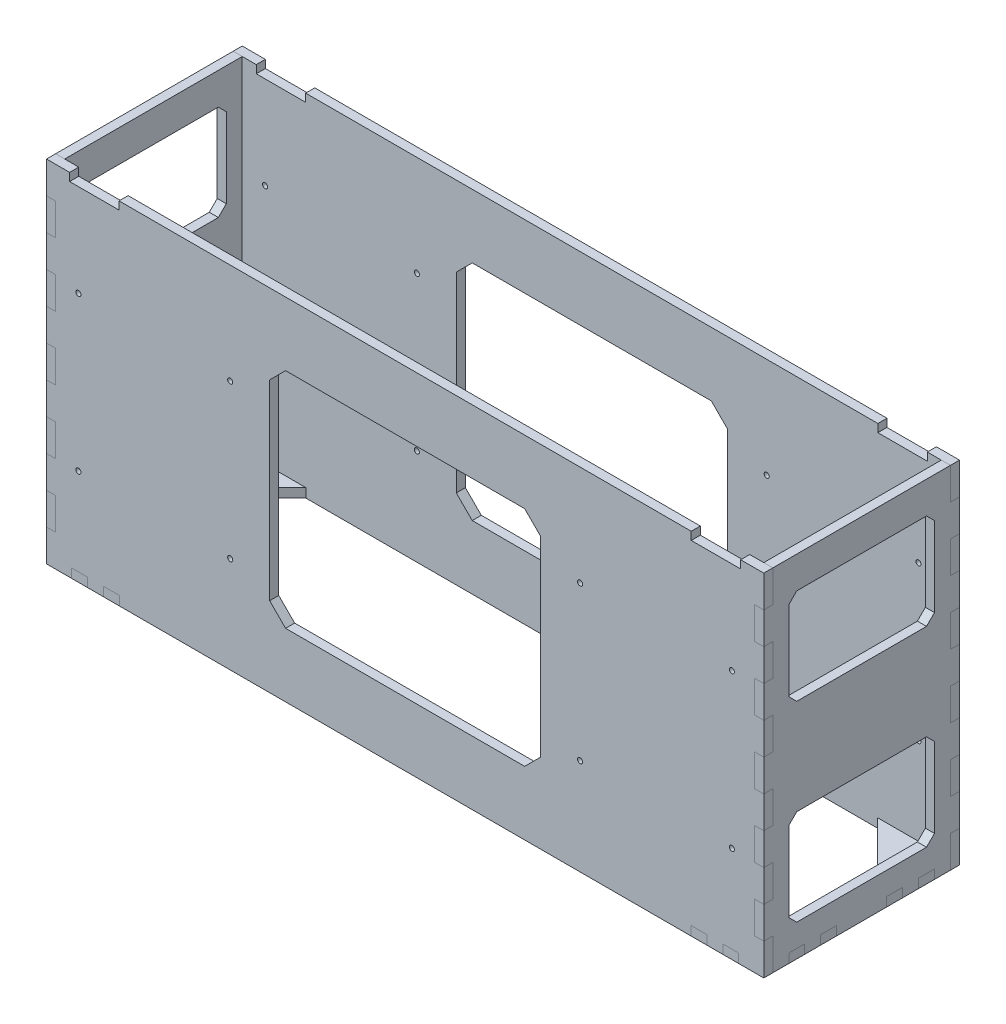
from build123d import *

# Parameters (mm, degrees)
SKETCH1_W                  = 450
SKETCH1_H                  = 220
SKETCH1_R                  = 1.6
BOSS_EXTRUDE1_DEPTH        = 5.7
CUT_EXTRUDE4_DEPTH         = 5.7
SKETCH2_W                  = 5.7
SKETCH2_H                  = 20
CUT_EXTRUDE1_DEPTH         = 5.7
LPATTERN1_COUNT            = 5
LPATTERN1_PITCH            = 40
MIRROR5_COPY_1_SKETCH_W    = 5.7
MIRROR5_COPY_1_SKETCH_H    = 20
MIRROR5_COPY_1_DEPTH       = 5.7
MIRROR5_COPY_2_SKETCH_W    = 5.7
MIRROR5_COPY_2_SKETCH_H    = 20
MIRROR5_COPY_2_DEPTH       = 5.7
MIRROR5_COPY_3_SKETCH_W    = 5.7
MIRROR5_COPY_3_SKETCH_H    = 20
MIRROR5_COPY_3_DEPTH       = 5.7
MIRROR5_COPY_4_SKETCH_W    = 5.7
MIRROR5_COPY_4_SKETCH_H    = 20
MIRROR5_COPY_4_DEPTH       = 5.7
SKETCH4_W                  = 122.8
SKETCH4_H                  = 220
BOSS_EXTRUDE2_DEPTH        = 5.7
SKETCH6_W                  = 5.7
SKETCH6_H                  = 20
CUT_EXTRUDE2_DEPTH         = 5.7
LPATTERN2_COUNT            = 6
LPATTERN2_PITCH            = 40
MIRROR3_COPY_1_SKETCH_W    = 5.7
MIRROR3_COPY_1_SKETCH_H    = 20
MIRROR3_COPY_1_DEPTH       = 5.7
MIRROR3_COPY_2_SKETCH_W    = 5.7
MIRROR3_COPY_2_SKETCH_H    = 20
MIRROR3_COPY_2_DEPTH       = 5.7
MIRROR3_COPY_3_SKETCH_W    = 5.7
MIRROR3_COPY_3_SKETCH_H    = 20
MIRROR3_COPY_3_DEPTH       = 5.7
MIRROR3_COPY_4_SKETCH_W    = 5.7
MIRROR3_COPY_4_SKETCH_H    = 20
MIRROR3_COPY_4_DEPTH       = 5.7
MIRROR3_COPY_5_SKETCH_W    = 5.7
MIRROR3_COPY_5_SKETCH_H    = 20
MIRROR3_COPY_5_DEPTH       = 5.7
CUT_EXTRUDE3_DEPTH         = 5.7
SKETCH9_W                  = 31
SKETCH9_H                  = 5
CUT_EXTRUDE5_DEPTH         = 516.732333677
SKETCH11_W                 = 10
SKETCH11_H                 = 5.7
SKETCH11_W_2               = 5.7
SKETCH11_H_2               = 10
CUT_EXTRUDE6_DEPTH         = 5.7
BOSS_EXTRUDE3_DEPTH        = 5.7
MIRROR12_COPY_1_SKETCH_W   = 10
MIRROR12_COPY_1_SKETCH_H   = 5.7
MIRROR12_COPY_1_SKETCH_W_2 = 5.7
MIRROR12_COPY_1_SKETCH_H_2 = 10
MIRROR12_COPY_1_DEPTH      = 5.7


with BuildPart() as part:
    # Sketch1 → Boss-Extrude1 (new body)
    with BuildSketch(Plane.XY):
        with Locations((225, 110)):
            Rectangle(SKETCH1_W, SKETCH1_H)
        with Locations((20, 157)):
            Circle(SKETCH1_R, mode=Mode.SUBTRACT)
        with Locations((115.25, 157)):
            Circle(SKETCH1_R, mode=Mode.SUBTRACT)
        with Locations((115.25, 60.48)):
            Circle(SKETCH1_R, mode=Mode.SUBTRACT)
        with Locations((20, 60.48)):
            Circle(SKETCH1_R, mode=Mode.SUBTRACT)
        with Locations(Location((430, 60.48, 0), (0, 0, 180))):
            Circle(SKETCH1_R, mode=Mode.SUBTRACT)
        with Locations(Location((334.75, 60.48, 0), (0, 0, 180))):
            Circle(SKETCH1_R, mode=Mode.SUBTRACT)
        with Locations(Location((334.75, 157, 0), (0, 0, 180))):
            Circle(SKETCH1_R, mode=Mode.SUBTRACT)
        with Locations(Location((430, 157, 0), (0, 0, 180))):
            Circle(SKETCH1_R, mode=Mode.SUBTRACT)
    extrude(amount=BOSS_EXTRUDE1_DEPTH)

    # Sketch8 → Cut-Extrude4 (cut)
    with BuildSketch(Plane(origin=(0, 0, 0), x_dir=(-1, 0, 0), z_dir=(0, 0, -1))):
        Polygon((-300, 180), (-150, 180), (-140, 170), (-140, 50), (-150, 40), (-300, 40), (-310, 50), (-310, 170), align=None)
    extrude(amount=-CUT_EXTRUDE4_DEPTH, mode=Mode.SUBTRACT)

    # Sketch2 → Cut-Extrude1 (cut)
    with BuildSketch(Plane.XY.offset(5.7)):
        with Locations((2.85, 190)):
            Rectangle(SKETCH2_W, SKETCH2_H)
    cut_extrude1 = extrude(amount=-CUT_EXTRUDE1_DEPTH, mode=Mode.SUBTRACT)

    # LPattern1: Cut-Extrude1 ×5
    with Locations(*[(0, -i * LPATTERN1_PITCH, 0) for i in range(1, LPATTERN1_COUNT)]):
        add(cut_extrude1, mode=Mode.SUBTRACT)

    # Mirror5: Cut-Extrude1 across plane
    add(cut_extrude1.mirror(Plane.ZY.offset(-225)), mode=Mode.SUBTRACT)

    # Mirror5 copy 1 sketch → Mirror5 copy 1 (cut)
    with BuildSketch(Plane(origin=(450, -40, 5.7), x_dir=(-1, 0, 0), z_dir=(0, 0, 1))):
        with Locations((2.85, -190)):
            Rectangle(MIRROR5_COPY_1_SKETCH_W, MIRROR5_COPY_1_SKETCH_H)
    extrude(amount=-MIRROR5_COPY_1_DEPTH, mode=Mode.SUBTRACT)

    # Mirror5 copy 2 sketch → Mirror5 copy 2 (cut)
    with BuildSketch(Plane(origin=(450, -80, 5.7), x_dir=(-1, 0, 0), z_dir=(0, 0, 1))):
        with Locations((2.85, -190)):
            Rectangle(MIRROR5_COPY_2_SKETCH_W, MIRROR5_COPY_2_SKETCH_H)
    extrude(amount=-MIRROR5_COPY_2_DEPTH, mode=Mode.SUBTRACT)

    # Mirror5 copy 3 sketch → Mirror5 copy 3 (cut)
    with BuildSketch(Plane(origin=(450, -120, 5.7), x_dir=(-1, 0, 0), z_dir=(0, 0, 1))):
        with Locations((2.85, -190)):
            Rectangle(MIRROR5_COPY_3_SKETCH_W, MIRROR5_COPY_3_SKETCH_H)
    extrude(amount=-MIRROR5_COPY_3_DEPTH, mode=Mode.SUBTRACT)

    # Mirror5 copy 4 sketch → Mirror5 copy 4 (cut)
    with BuildSketch(Plane(origin=(450, -160, 5.7), x_dir=(-1, 0, 0), z_dir=(0, 0, 1))):
        with Locations((2.85, -190)):
            Rectangle(MIRROR5_COPY_4_SKETCH_W, MIRROR5_COPY_4_SKETCH_H)
    extrude(amount=-MIRROR5_COPY_4_DEPTH, mode=Mode.SUBTRACT)


with BuildPart() as body_2:
    # Mirror2: mirrored copy
    add(part.part.mirror(Plane.XY.offset(61.4)))


with BuildPart() as body_3:
    # Sketch4 → Boss-Extrude2 (new body)
    with BuildSketch(Plane.ZY):
        with Locations((61.4, 110)):
            Rectangle(SKETCH4_W, SKETCH4_H)
    extrude(amount=-BOSS_EXTRUDE2_DEPTH)

    # Sketch6 → Cut-Extrude2 (cut)
    with BuildSketch(Plane.ZY):
        with Locations((2.85, 210)):
            Rectangle(SKETCH6_W, SKETCH6_H)
    cut_extrude2 = extrude(amount=-CUT_EXTRUDE2_DEPTH, mode=Mode.SUBTRACT)

    # LPattern2: Cut-Extrude2 ×6
    with Locations(*[(0, -i * LPATTERN2_PITCH, 0) for i in range(1, LPATTERN2_COUNT)]):
        add(cut_extrude2, mode=Mode.SUBTRACT)

    # Mirror3: Cut-Extrude2 across plane
    add(cut_extrude2.mirror(Plane.XY.offset(61.4)), mode=Mode.SUBTRACT)

    # Mirror3 copy 1 sketch → Mirror3 copy 1 (cut)
    with BuildSketch(Plane(origin=(0, -40, 122.8), x_dir=(0, 0, -1), z_dir=(-1, 0, 0))):
        with Locations((2.85, -210)):
            Rectangle(MIRROR3_COPY_1_SKETCH_W, MIRROR3_COPY_1_SKETCH_H)
    extrude(amount=-MIRROR3_COPY_1_DEPTH, mode=Mode.SUBTRACT)

    # Mirror3 copy 2 sketch → Mirror3 copy 2 (cut)
    with BuildSketch(Plane(origin=(0, -80, 122.8), x_dir=(0, 0, -1), z_dir=(-1, 0, 0))):
        with Locations((2.85, -210)):
            Rectangle(MIRROR3_COPY_2_SKETCH_W, MIRROR3_COPY_2_SKETCH_H)
    extrude(amount=-MIRROR3_COPY_2_DEPTH, mode=Mode.SUBTRACT)

    # Mirror3 copy 3 sketch → Mirror3 copy 3 (cut)
    with BuildSketch(Plane(origin=(0, -120, 122.8), x_dir=(0, 0, -1), z_dir=(-1, 0, 0))):
        with Locations((2.85, -210)):
            Rectangle(MIRROR3_COPY_3_SKETCH_W, MIRROR3_COPY_3_SKETCH_H)
    extrude(amount=-MIRROR3_COPY_3_DEPTH, mode=Mode.SUBTRACT)

    # Mirror3 copy 4 sketch → Mirror3 copy 4 (cut)
    with BuildSketch(Plane(origin=(0, -160, 122.8), x_dir=(0, 0, -1), z_dir=(-1, 0, 0))):
        with Locations((2.85, -210)):
            Rectangle(MIRROR3_COPY_4_SKETCH_W, MIRROR3_COPY_4_SKETCH_H)
    extrude(amount=-MIRROR3_COPY_4_DEPTH, mode=Mode.SUBTRACT)

    # Mirror3 copy 5 sketch → Mirror3 copy 5 (cut)
    with BuildSketch(Plane(origin=(0, -200, 122.8), x_dir=(0, 0, -1), z_dir=(-1, 0, 0))):
        with Locations((2.85, -210)):
            Rectangle(MIRROR3_COPY_5_SKETCH_W, MIRROR3_COPY_5_SKETCH_H)
    extrude(amount=-MIRROR3_COPY_5_DEPTH, mode=Mode.SUBTRACT)

    # Sketch7 → Cut-Extrude3 (cut)
    with BuildSketch(Plane.ZY):
        Polygon((20.7, 20), (102.1, 20), (107.1, 25), (107.1, 75), (102.1, 80), (20.7, 80), (15.7, 75), (15.7, 25), align=None)
    cut_extrude3 = extrude(amount=-CUT_EXTRUDE3_DEPTH, mode=Mode.SUBTRACT)

    # Mirror4: Cut-Extrude3 across plane
    add(cut_extrude3.mirror(Plane.ZX.offset(110)), mode=Mode.SUBTRACT)


with BuildPart() as cut_extrude5_tool:
    # Sketch9 → Cut-Extrude5 (new, through all)
    with BuildSketch(Plane(origin=(0, 0, 0), x_dir=(-1, 0, 0), z_dir=(0, 0, -1))):
        with Locations((-30, 217.5)):
            Rectangle(SKETCH9_W, SKETCH9_H)
    cut_extrude5 = extrude(amount=-CUT_EXTRUDE5_DEPTH)


with BuildPart() as part_1:
    add(part.part)

    # Cut-Extrude5: cut by cut_extrude5_tool
    add(cut_extrude5_tool.part, mode=Mode.SUBTRACT)


with BuildPart() as body_2_1:
    add(body_2.part)

    # Cut-Extrude5: cut by cut_extrude5_tool
    add(cut_extrude5_tool.part, mode=Mode.SUBTRACT)


with BuildPart() as mirror6_tool:
    # Mirror6: Cut-Extrude5 across plane
    add(cut_extrude5.mirror(Plane.ZY.offset(-225)))


with BuildPart() as part_2:
    add(part_1.part)

    # Mirror6: cut by mirror6_tool
    add(mirror6_tool.part, mode=Mode.SUBTRACT)


with BuildPart() as body_2_2:
    add(body_2_1.part)

    # Mirror6: cut by mirror6_tool
    add(mirror6_tool.part, mode=Mode.SUBTRACT)


with BuildPart() as cut_extrude6_tool:
    # Sketch11 → Cut-Extrude6 (new body)
    with BuildSketch(Plane.XZ):
        with Locations((20.7, 119.95)):
            Rectangle(SKETCH11_W, SKETCH11_H)
        with Locations((40.7, 119.95)):
            Rectangle(SKETCH11_W, SKETCH11_H)
        with Locations((2.85, 102.1)):
            Rectangle(SKETCH11_W_2, SKETCH11_H_2)
        with Locations((2.85, 82.1)):
            Rectangle(SKETCH11_W_2, SKETCH11_H_2)
    cut_extrude6 = extrude(amount=-CUT_EXTRUDE6_DEPTH)


with BuildPart() as body_2_3:
    add(body_2_2.part)

    # Cut-Extrude6: cut by cut_extrude6_tool
    add(cut_extrude6_tool.part, mode=Mode.SUBTRACT)

    # Mirror12: Cut-Extrude6 across plane
    add(cut_extrude6.mirror(Plane.ZY.offset(-225)), mode=Mode.SUBTRACT)


with BuildPart() as body_3_1:
    add(body_3.part)

    # Cut-Extrude6: cut by cut_extrude6_tool
    add(cut_extrude6_tool.part, mode=Mode.SUBTRACT)


with BuildPart() as body_4:
    # Sketch12 → Boss-Extrude3 (new body)
    with BuildSketch(Plane.XZ):
        Polygon((45.7, 117.1), (45.7, 122.8), (35.7, 122.8), (35.7, 117.1), (25.7, 117.1), (25.7, 122.8), (15.7, 122.8), (15.7, 117.1), (5.7, 117.1), (5.7, 107.1), (0, 107.1), (0, 97.1), (5.7, 97.1), (5.7, 87.1), (0, 87.1), (0, 77.1), (5.7, 77.1), align=None)
    extrude(amount=-BOSS_EXTRUDE3_DEPTH)


with BuildPart() as mirror10_tool:
    # Mirror10: Cut-Extrude6 across plane
    add(cut_extrude6.mirror(Plane.XY.offset(61.4)))


with BuildPart() as part_3:
    add(part_2.part)

    # Mirror10: cut by mirror10_tool
    add(mirror10_tool.part, mode=Mode.SUBTRACT)

    # Mirror12 copy 1 sketch → Mirror12 copy 1 (cut)
    with BuildSketch(Plane(origin=(450, 0, 122.8), x_dir=(-1, 0, 0), z_dir=(0, -1, 0))):
        with Locations((20.7, 119.95)):
            Rectangle(MIRROR12_COPY_1_SKETCH_W, MIRROR12_COPY_1_SKETCH_H)
        with Locations((40.7, 119.95)):
            Rectangle(MIRROR12_COPY_1_SKETCH_W, MIRROR12_COPY_1_SKETCH_H)
        with Locations((2.85, 102.1)):
            Rectangle(MIRROR12_COPY_1_SKETCH_W_2, MIRROR12_COPY_1_SKETCH_H_2)
        with Locations((2.85, 82.1)):
            Rectangle(MIRROR12_COPY_1_SKETCH_W_2, MIRROR12_COPY_1_SKETCH_H_2)
    extrude(amount=-MIRROR12_COPY_1_DEPTH, mode=Mode.SUBTRACT)


with BuildPart() as body_3_2:
    add(body_3_1.part)

    # Mirror10: cut by mirror10_tool
    add(mirror10_tool.part, mode=Mode.SUBTRACT)


with BuildPart() as body_5:
    # Mirror11: mirrored copy
    add(body_3_2.part.mirror(Plane.ZY.offset(-225)))


with BuildPart() as body_6:
    # Mirror14: mirrored copy
    add(body_4.part.mirror(Plane.XY.offset(61.4)))


with BuildPart() as body_7:
    # Mirror15: mirrored copy
    add(body_6.part.mirror(Plane.ZY.offset(-225)))


with BuildPart() as body_8:
    # Mirror15 2: mirrored copy
    add(body_4.part.mirror(Plane.ZY.offset(-225)))


solid = Compound([body_2_3.part, body_4.part, part_3.part, body_3_2.part, body_5.part, body_6.part, body_7.part, body_8.part])
